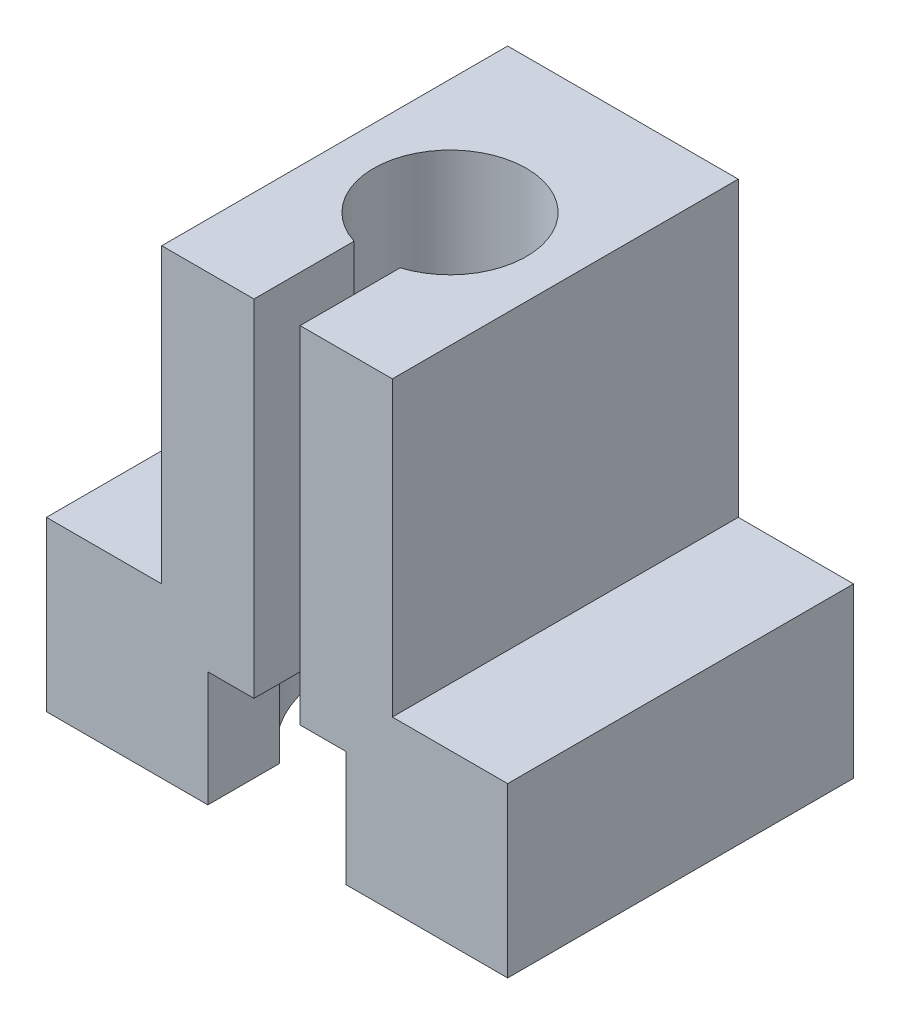
from build123d import *

# Parameters (mm, degrees)
SKETCH1_W           = 10
SKETCH1_H           = 15
BOSS_EXTRUDE1_DEPTH = 15
SKETCH3_W           = 5
SKETCH3_H           = 2.3
BOSS_EXTRUDE2_DEPTH = 15
SKETCH4_R           = 3.315
CUT_EXTRUDE1_DEPTH  = 24.452078799
SKETCH6_W           = 2
SKETCH6_H           = 15
CUT_EXTRUDE2_DEPTH  = 8
BOSS_EXTRUDE3_DEPTH = 5


with BuildPart() as part:
    # Sketch1 → Boss-Extrude1 (new body)
    with BuildSketch(Plane.XY):
        Rectangle(SKETCH1_W, SKETCH1_H)
    extrude(amount=BOSS_EXTRUDE1_DEPTH)

    # Sketch3 → Boss-Extrude2 (add)
    with BuildSketch(Plane.XY.offset(15)):
        with Locations((-7.5, -6.35)):
            Rectangle(SKETCH3_W, SKETCH3_H)
        with Locations((7.5, -6.35)):
            Rectangle(SKETCH3_W, SKETCH3_H)
    extrude(amount=-BOSS_EXTRUDE2_DEPTH)

    # Sketch4 → Cut-Extrude1 (cut, through all)
    with BuildSketch(Plane.XZ.offset(7.5)):
        with Locations(Location((0, 7.5, 0), (0, 0, 270))):
            Circle(SKETCH4_R)
    extrude(amount=-CUT_EXTRUDE1_DEPTH, mode=Mode.SUBTRACT)

    # Sketch6 → Cut-Extrude2 (cut)
    with BuildSketch(Plane.XY.offset(15)):
        Rectangle(SKETCH6_W, SKETCH6_H)
    extrude(amount=-CUT_EXTRUDE2_DEPTH, mode=Mode.SUBTRACT)

    # Sketch7 → Boss-Extrude3 (add)
    with BuildSketch(Plane.XZ.offset(7.5)):
        with BuildLine():
            Line((3, 15), (10, 15))
            Line((10, 15), (10, 0))
            Line((10, 0), (-10, 0))
            Line((-10, 0), (-10, 15))
            Line((-10, 15), (-3, 15))
            Line((-3, 15), (-3, 11.887393873))
            ThreePointArc((-3, 11.887393873), (0, 2.185), (3, 11.887393873))
            Line((3, 11.887393873), (3, 15))
        make_face()
    extrude(amount=BOSS_EXTRUDE3_DEPTH)


solid = part.part
